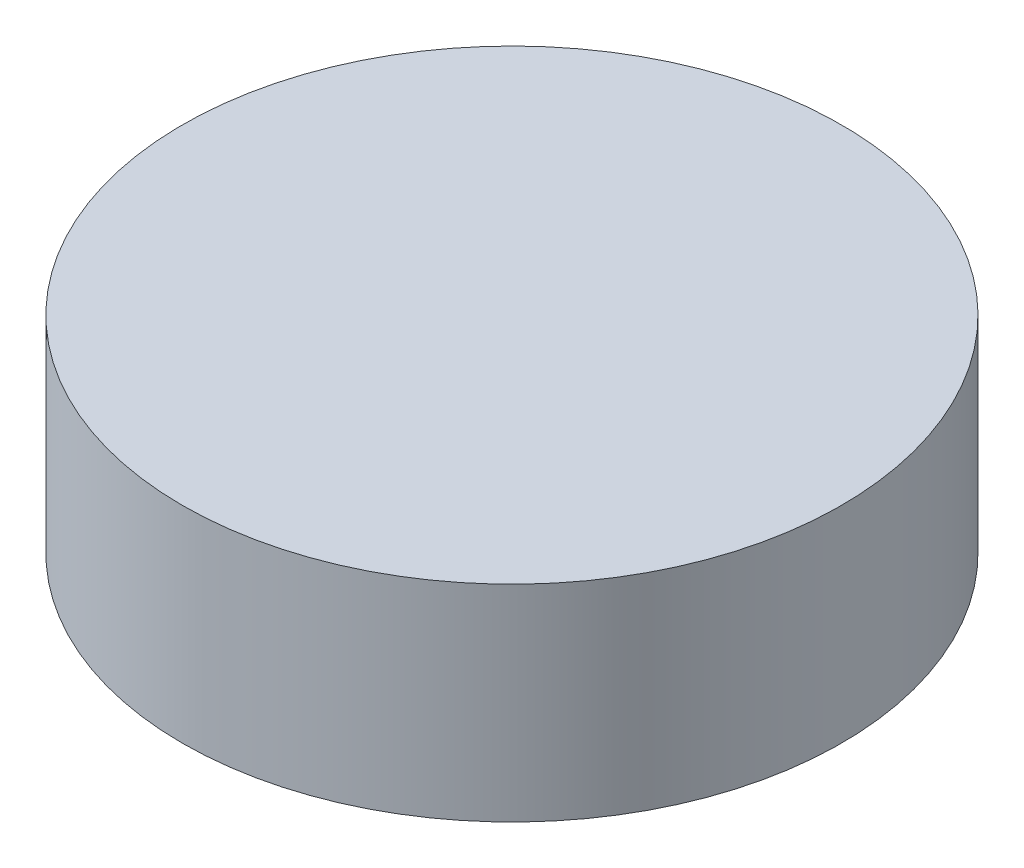
from build123d import *

# Parameters (mm, degrees)
SKETCH1_R           = 2.54
BOSS_EXTRUDE1_DEPTH = 0.79375


with BuildPart() as part:
    # Sketch1 → Boss-Extrude1 (new, symmetric)
    with BuildSketch(Plane(origin=(0, 0, 0), x_dir=(1, 0, 0), z_dir=(0, 1, 0))):
        with Locations(Location((0, 0, 0), (0, 0, 270))):
            Circle(SKETCH1_R)
    extrude(amount=BOSS_EXTRUDE1_DEPTH, both=True)


solid = part.part
